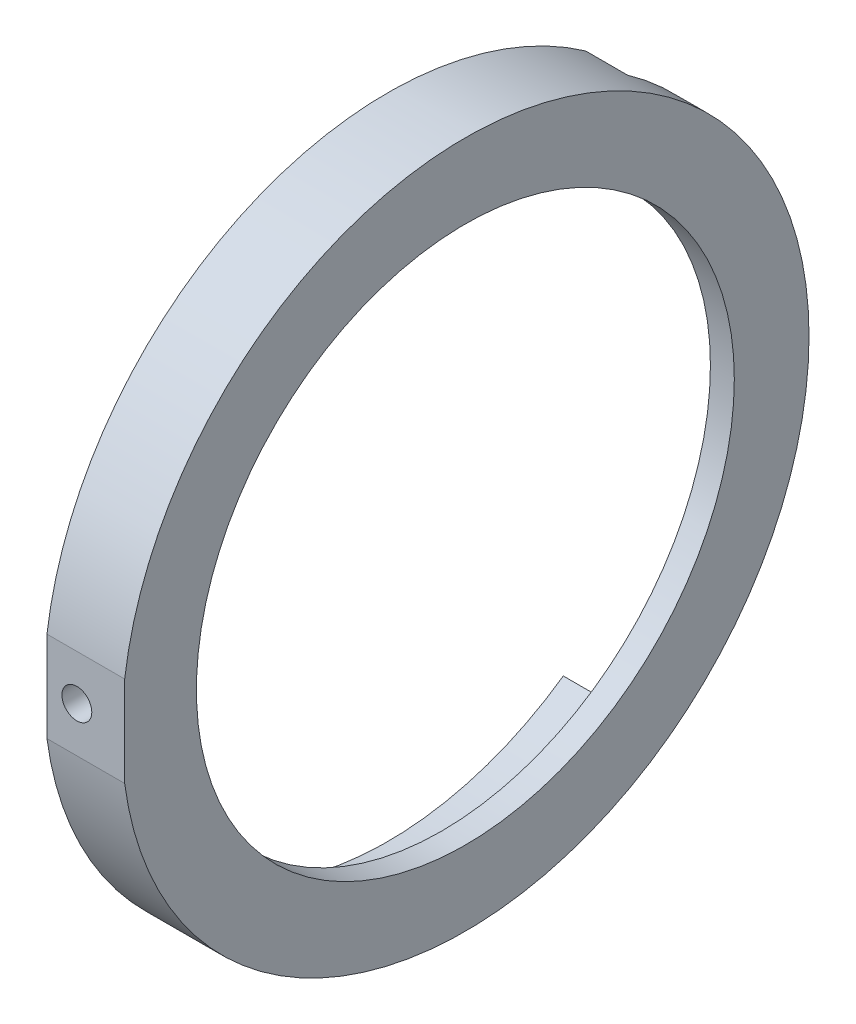
from build123d import *
from build123d.topology import SkipClean

# Parameters (mm, degrees)
BOSS_EXTRUDE1_DEPTH = 6
BOSS_EXTRUDE2_START = 7
BOSS_EXTRUDE2_DEPTH = 7
SKETCH3_R           = 2.5
CUT_EXTRUDE1_DEPTH  = 7
CUT_EXTRUDE2_REACH  = 84.35
SKETCH5_R           = 51
CUT_EXTRUDE3_DEPTH  = 2


with BuildPart() as part:
    # Sketch1 → Boss-Extrude1 (new body)
    with BuildSketch(Plane(origin=(0, 0, 0), x_dir=(0, 0, -1), z_dir=(1, 0, 0))):
        with BuildLine():
            Line((-57, 7.566372975), (-57, -7.566372975))
            ThreePointArc((-57, -7.566372975), (57.5, 0), (-57, 7.566372975))
        make_face()
    extrude(amount=BOSS_EXTRUDE1_DEPTH)

    # Sketch2 → Boss-Extrude2 (add)
    with SkipClean():  # the faces are left unmerged after this step: merging them gives an invalid solid
        with BuildSketch(Plane.ZY.offset(BOSS_EXTRUDE2_START)):
            with BuildLine():
                Line((-29.380225594, -41.686956522), (-33.12476415, -47))
                ThreePointArc((-33.12476415, -47), (23.049066289, -52.678179004), (57, -7.566372975))
                Line((57, -7.566372975), (57, 7.566372975))
                ThreePointArc((57, 7.566372975), (23.049066289, 52.678179004), (-33.12476415, 47))
                Line((-33.12476415, 47), (-29.380225594, 41.686956522))
                ThreePointArc((-29.380225594, 41.686956522), (20.443519665, 46.723254421), (50.556521739, 6.711043856))
                ThreePointArc((50.556521739, 6.711043856), (50.889009662, 3.362840414), (51, 0))
                ThreePointArc((51, 0), (50.889009662, -3.362840414), (50.556521739, -6.711043856))
                ThreePointArc((50.556521739, -6.711043856), (20.443519665, -46.723254421), (-29.380225594, -41.686956522))
            make_face()
        extrude(amount=-BOSS_EXTRUDE2_DEPTH)

    # Sketch3 → Cut-Extrude1 (cut)
    with SkipClean():  # the faces are left unmerged after this step: merging them gives an invalid solid
        with BuildSketch(Plane.XY.offset(57)):
            with Locations((-2, 0)):
                Circle(SKETCH3_R)
        extrude(amount=-CUT_EXTRUDE1_DEPTH, mode=Mode.SUBTRACT)

    # Sketch4 → Cut-Extrude2 (cut, up to next)
    with BuildSketch(Plane(origin=(6, 0, 0), x_dir=(0, 0, -1), z_dir=(1, 0, 0)), mode=Mode.PRIVATE) as cut_extrude2_sk1:
        with BuildLine():
            ThreePointArc((-44.60706125, -5.933808779), (44.999999572, 0.006203806), (-44.608695652, 5.921509285))
            ThreePointArc((-44.608695652, 5.921509285), (-45, 0), (-44.608695652, -5.921509285))
            ThreePointArc((-44.608695652, -5.921509285), (-44.607878875, -5.927659088), (-44.60706125, -5.933808779))
        make_face()
    cut_extrude2_tool1 = extrude(cut_extrude2_sk1.sketch, amount=-CUT_EXTRUDE2_REACH, mode=Mode.PRIVATE) & part.part
    add(cut_extrude2_tool1.solids().sort_by_distance((6, 0, 0))[0], mode=Mode.SUBTRACT)

    # Sketch5 → Cut-Extrude3 (cut)
    with SkipClean():  # the faces are left unmerged after this step: merging them gives an invalid solid
        with BuildSketch(Plane.ZY):
            with Locations(Location((0, 0, 0), (0, 0, 234.824499503))):
                Circle(SKETCH5_R)
        extrude(amount=-CUT_EXTRUDE3_DEPTH, mode=Mode.SUBTRACT)


solid = part.part
